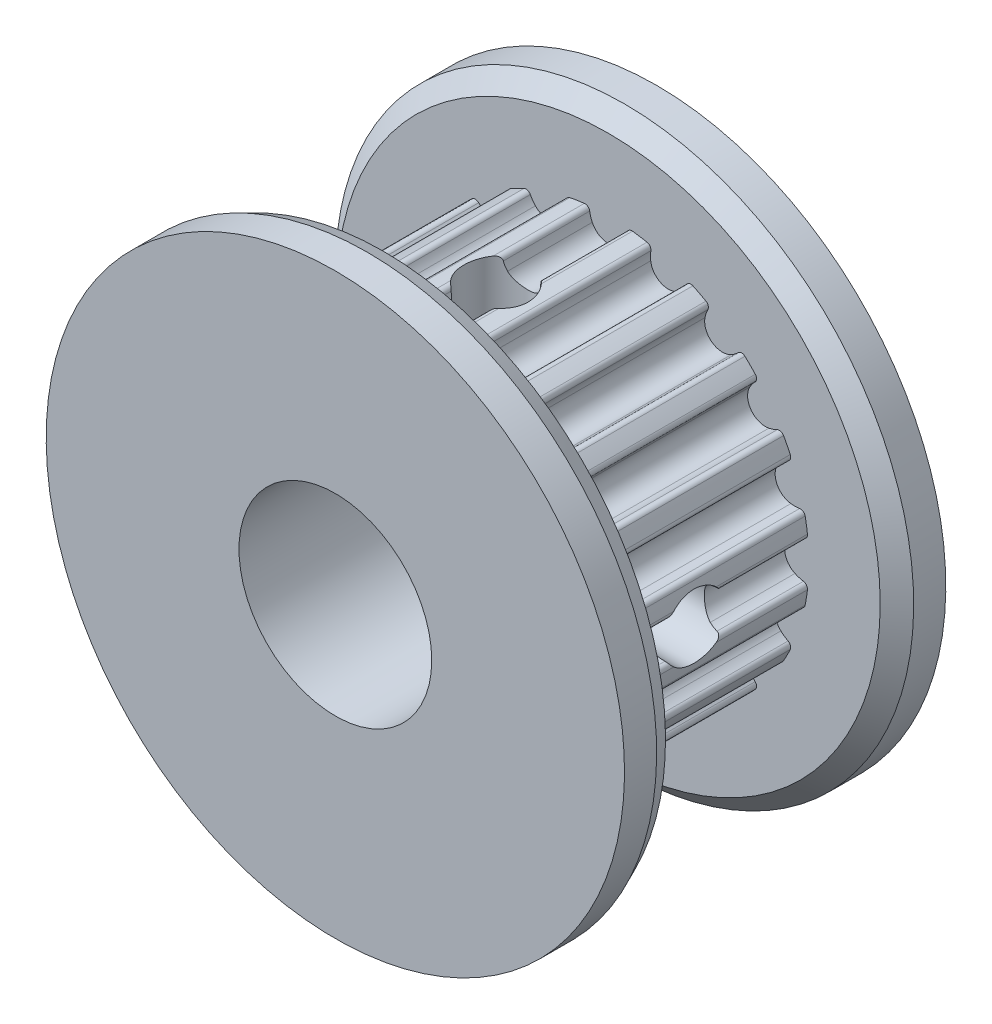
from build123d import *

# Parameters (mm, degrees)
CROQUIS1_R                 = 6.366
SALIENTE_EXTRUIR1_DEPTH    = 7
CORTAR_EXTRUIR1_DEPTH      = 12.404030516
MATRIZC1_COUNT             = 20
CROQUIS6_R                 = 3
CORTAR_EXTRUIR2_DEPTH      = 17.186414056
CORTAR_EXTRUIR3_DEPTH      = 16.305227865
CORTAR_EXTRUIR3_DEPTH_BACK = 16.305227865
CROQUIS7_R                 = 1
CORTAR_EXTRUIR4_DEPTH      = 16.305227921
CORTAR_EXTRUIR4_DEPTH_BACK = 16.305227921
CROQUIS8_R                 = 1


with BuildPart() as part:
    # Croquis1 → Saliente-Extruir1 (new body)
    with BuildSketch(Plane.XY):
        Circle(CROQUIS1_R)
    extrude(amount=SALIENTE_EXTRUIR1_DEPTH)

    # Croquis3 → Cortar-Extruir1 (cut, through all)
    with BuildSketch(Plane(origin=(0, 0, 0), x_dir=(-1, 0, 0), z_dir=(0, 0, -1))):
        with BuildLine():
            Line((-7.140411071, 45.082781216), (-0.995861804, 6.287623976))
            Line((-0.995861804, 6.287623976), (-0.975994627, 6.162187557))
            ThreePointArc((-0.975994627, 6.162187557), (-0.863064611, 6.179016142), (-0.749845546, 6.193775315))
            ThreePointArc((-0.749845546, 6.193775315), (-0.641504612, 6.164627299), (-0.583688192, 6.068478318))
            ThreePointArc((-0.583688192, 6.068478318), (-0.55273127, 5.93441999), (-0.503666473, 5.805879678))
            ThreePointArc((-0.503666473, 5.805879678), (0, 5.484), (0.503666473, 5.805879678))
            ThreePointArc((0.503666473, 5.805879678), (0.55273127, 5.93441999), (0.583688192, 6.068478318))
            ThreePointArc((0.583688192, 6.068478318), (0.641504612, 6.164627299), (0.749845546, 6.193775315))
            ThreePointArc((0.749845546, 6.193775315), (0.863064611, 6.179016142), (0.975994627, 6.162187557))
            Line((0.975994627, 6.162187557), (0.995861804, 6.287623976))
            Line((0.995861804, 6.287623976), (7.140411071, 45.082781216))
            Line((7.140411071, 45.082781216), (7.140411071, 123.640268725))
            Line((7.140411071, 123.640268725), (-7.140411071, 123.640268725))
            Line((-7.140411071, 123.640268725), (-7.140411071, 45.082781216))
        make_face()
    cortar_extruir1 = extrude(amount=-CORTAR_EXTRUIR1_DEPTH, mode=Mode.SUBTRACT)

    # MatrizC1: Cortar-Extruir1 ×20 about axis
    matrizc1_axis = Axis((0, 0, 0), (0, 0, 1))
    for i in range(1, MATRIZC1_COUNT):
        add(cortar_extruir1.rotate(matrizc1_axis, i * 360 / MATRIZC1_COUNT), mode=Mode.SUBTRACT)

    # Croquis5 → Revolución1 (revolve)
    with BuildSketch(Plane(origin=(0, 0, 0), x_dir=(0, 0, -1), z_dir=(1, 0, 0))):
        Polygon((0, 0), (1.5, 0), (1.5, 9), (0.5, 9), (0, 8.458311378), align=None)
        Polygon((-7, 0), (-8.5, 0), (-8.5, 9), (-7.5, 9), (-7, 8.776025475), align=None)
    revolve(axis=Axis((0, 0, 7), (0, 0, 1)))

    # Croquis6 → Cortar-Extruir2 (cut, through all)
    with BuildSketch(Plane.XY.offset(8.5)):
        Circle(CROQUIS6_R)
    extrude(amount=-CORTAR_EXTRUIR2_DEPTH, mode=Mode.SUBTRACT)

    # Croquis7 → Cortar-Extruir3 (cut, two sides: drawn at the far end of the back side and taken through both)
    with BuildSketch(Plane(origin=(0, 0, 0), x_dir=(0, 0, -1), z_dir=(1, 0, 0)).offset(-CORTAR_EXTRUIR3_DEPTH_BACK)):
        with Locations((-3.5, 0)):
            Circle(CROQUIS7_R)
    extrude(amount=CORTAR_EXTRUIR3_DEPTH + CORTAR_EXTRUIR3_DEPTH_BACK, mode=Mode.SUBTRACT)

    # Croquis8 → Cortar-Extruir4 (cut, two sides: drawn at the far end of the back side and taken through both)
    with BuildSketch(Plane(origin=(0, 0, 0), x_dir=(1, 0, 0), z_dir=(0, 1, 0)).offset(-CORTAR_EXTRUIR4_DEPTH_BACK)):
        with Locations(Location((0, -3.5, 0), (0, 0, 270))):
            Circle(CROQUIS8_R)
    extrude(amount=CORTAR_EXTRUIR4_DEPTH + CORTAR_EXTRUIR4_DEPTH_BACK, mode=Mode.SUBTRACT)


solid = part.part
